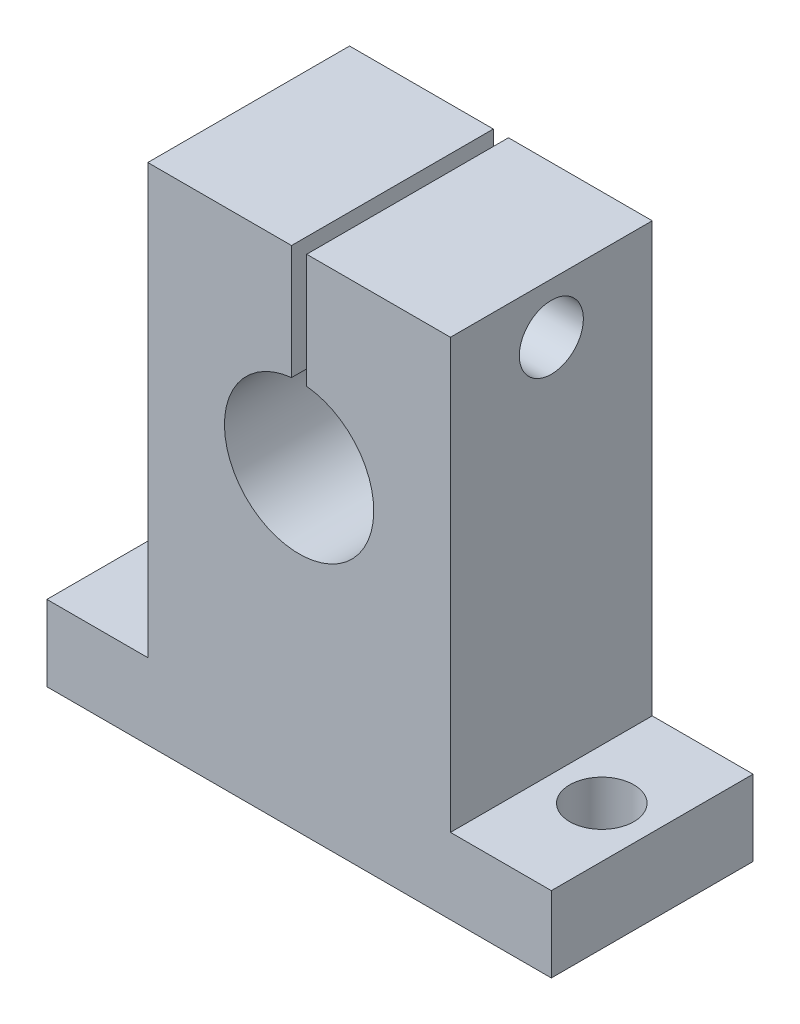
from build123d import *

# Parameters (mm, degrees)
SALIENTE_EXTRUIR1_DEPTH    = 20
CROQUIS2_R                 = 3.175
CORTAR_EXTRUIR1_DEPTH      = 54.209491634
CORTAR_EXTRUIR2_DEPTH      = 55.586536802
CORTAR_EXTRUIR2_DEPTH_BACK = 55.586536802
CROQUIS3_R                 = 3.175


with BuildPart() as part:
    # Croquis1 → Saliente-Extruir1 (new body)
    with BuildSketch(Plane.XY):
        with BuildLine():
            Line((-15, 18.7), (-0.75, 18.7))
            Line((-0.75, 18.7), (-0.75, 7.361895136))
            ThreePointArc((-0.75, 7.361895136), (0, -7.4), (0.75, 7.361895136))
            Line((0.75, 7.361895136), (0.75, 18.7))
            Line((0.75, 18.7), (15, 18.7))
            Line((15, 18.7), (15, -23.8))
            Line((15, -23.8), (25, -23.8))
            Line((25, -23.8), (25, -31.3))
            Line((25, -31.3), (-25, -31.3))
            Line((-25, -31.3), (-25, -23.8))
            Line((-25, -23.8), (-15, -23.8))
            Line((-15, -23.8), (-15, 18.7))
        make_face()
    extrude(amount=SALIENTE_EXTRUIR1_DEPTH)

    # Croquis2 → Cortar-Extruir1 (cut, through all)
    with BuildSketch(Plane(origin=(0, -23.8, 0), x_dir=(1, 0, 0), z_dir=(0, 1, 0))):
        with Locations(Location((-20, -10, 0), (0, 0, 270))):
            Circle(CROQUIS2_R)
        with Locations(Location((20, -10, 0), (0, 0, 270))):
            Circle(CROQUIS2_R)
    extrude(amount=-CORTAR_EXTRUIR1_DEPTH, mode=Mode.SUBTRACT)

    # Croquis3 → Cortar-Extruir2 (cut, two sides: drawn at the far end of the back side and taken through both)
    with BuildSketch(Plane(origin=(15, 0, 0), x_dir=(0, 0, -1), z_dir=(1, 0, 0)).offset(-CORTAR_EXTRUIR2_DEPTH_BACK)):
        with Locations(Location((-10, 13.7, 0), (0, 0, 90))):
            Circle(CROQUIS3_R)
    extrude(amount=CORTAR_EXTRUIR2_DEPTH + CORTAR_EXTRUIR2_DEPTH_BACK, mode=Mode.SUBTRACT)


solid = part.part
